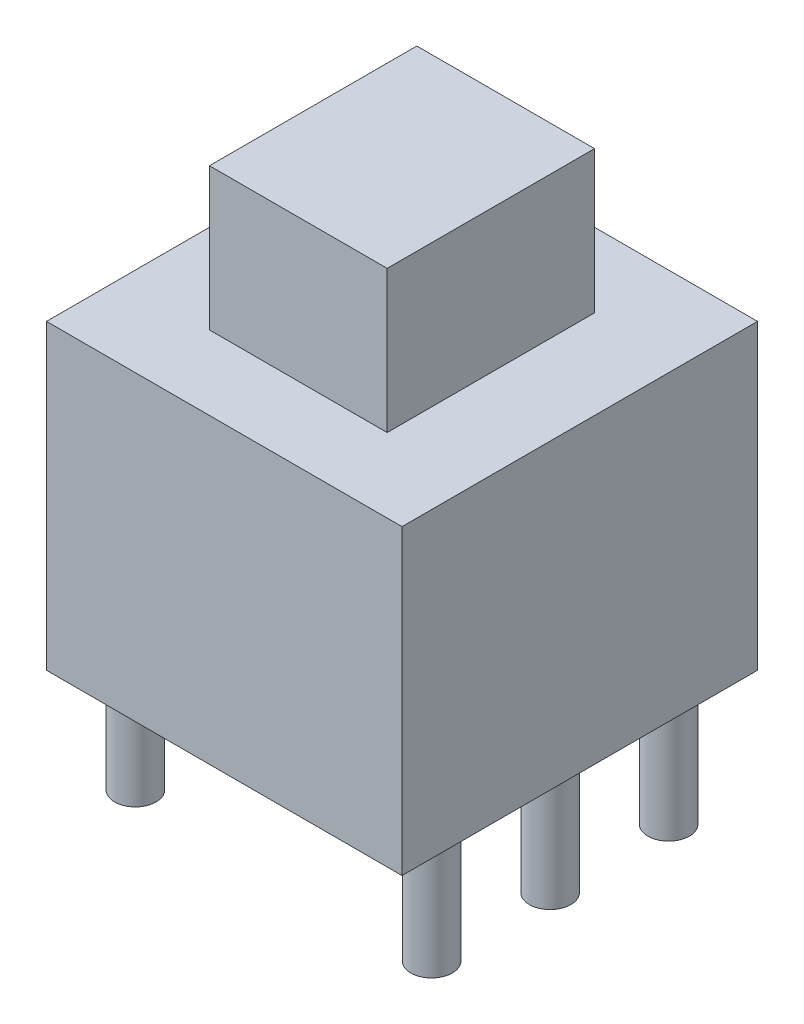
from build123d import *

# Parameters (mm, degrees)
SKETCH1_W           = 6
SKETCH1_H           = 6
BOSS_EXTRUDE1_DEPTH = 5.1
SKETCH2_W           = 3
SKETCH2_H           = 3.5
BOSS_EXTRUDE2_DEPTH = 2.4
SKETCH3_R           = 0.35
BOSS_EXTRUDE3_DEPTH = 2


with BuildPart() as part:
    # Sketch1 → Boss-Extrude1 (new body)
    with BuildSketch(Plane(origin=(0, 0, 0), x_dir=(1, 0, 0), z_dir=(0, 1, 0))):
        Rectangle(SKETCH1_W, SKETCH1_H)
    extrude(amount=BOSS_EXTRUDE1_DEPTH)

    # Sketch2 → Boss-Extrude2 (add)
    with BuildSketch(Plane(origin=(0, 5.1, 0), x_dir=(1, 0, 0), z_dir=(0, 1, 0))):
        Rectangle(SKETCH2_W, SKETCH2_H)
    extrude(amount=BOSS_EXTRUDE2_DEPTH)

    # Sketch3 → Boss-Extrude3 (add)
    with BuildSketch(Plane.XZ):
        with Locations(Location((-2.5, 0, 0), (0, 0, 270))):
            Circle(SKETCH3_R)
        with Locations(Location((-2.5, -2, 0), (0, 0, 270))):
            Circle(SKETCH3_R)
        with Locations(Location((-2.5, 2, 0), (0, 0, 270))):
            Circle(SKETCH3_R)
        with Locations(Location((2.5, -2, 0), (0, 0, 90))):
            Circle(SKETCH3_R)
        with Locations(Location((2.5, 0, 0), (0, 0, 90))):
            Circle(SKETCH3_R)
        with Locations(Location((2.5, 2, 0), (0, 0, 90))):
            Circle(SKETCH3_R)
    extrude(amount=BOSS_EXTRUDE3_DEPTH)


solid = part.part
